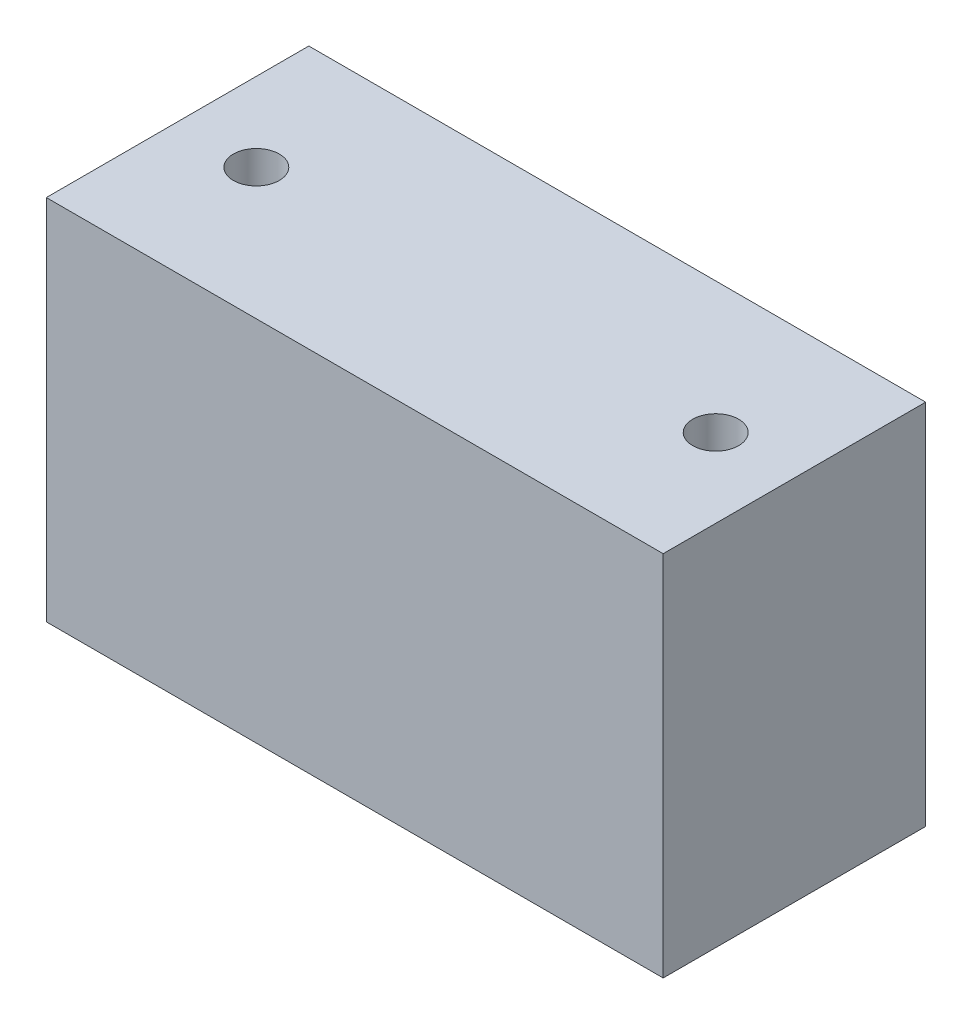
from build123d import *

# Parameters (mm, degrees)
SKETCH1_W           = 47
SKETCH1_H           = 20
BOSS_EXTRUDE1_DEPTH = 28
SKETCH2_R           = 1.75
CUT_EXTRUDE1_DEPTH  = 38.897889123


with BuildPart() as part:
    # Sketch1 → Boss-Extrude1 (new body)
    with BuildSketch(Plane(origin=(0, 0, 0), x_dir=(1, 0, 0), z_dir=(0, 1, 0))):
        Rectangle(SKETCH1_W, SKETCH1_H)
    extrude(amount=BOSS_EXTRUDE1_DEPTH)

    # Sketch2 → Cut-Extrude1 (cut, through all)
    with BuildSketch(Plane(origin=(0, 28, 0), x_dir=(1, 0, 0), z_dir=(0, 1, 0))):
        with Locations(Location((-17.5, 0, 0), (0, 0, 270))):
            Circle(SKETCH2_R)
        with Locations(Location((17.5, 0, 0), (0, 0, 270))):
            Circle(SKETCH2_R)
    extrude(amount=-CUT_EXTRUDE1_DEPTH, mode=Mode.SUBTRACT)


solid = part.part
